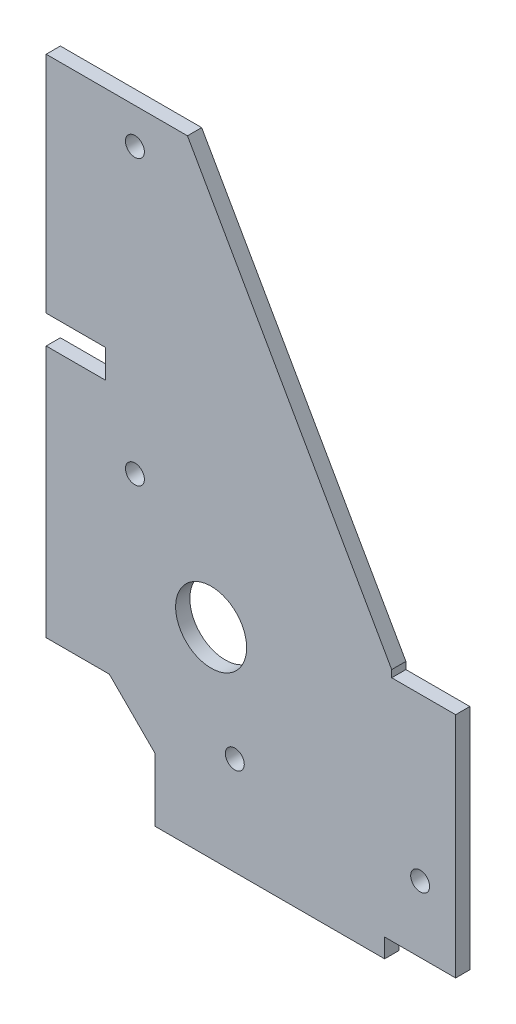
from build123d import *

# Parameters (mm, degrees)
BOSS_EXTRUDE1_DEPTH     = 6
SKETCH2_R               = 4
SKETCH2_R_2             = 15
CUT_EXTRUDE1_DEPTH      = 313.353853826
CROQUIS2_W              = 97
CROQUIS2_H              = 0.3
CORTAR_EXTRUIR1_DEPTH   = 10
CORTAR_EXTRUIR2_DEPTH   = 10
CROQUIS4_R              = 4
CORTAR_EXTRUIR3_DEPTH   = 6
SALIENTE_EXTRUIR2_DEPTH = 6
CROQUIS7_W              = 0.3
CROQUIS7_H              = 222.05
CORTAR_EXTRUIR4_DEPTH   = 6
CROQUIS8_W              = 25
CROQUIS8_H              = 12
CORTAR_EXTRUIR5_DEPTH   = 6
SALIENTE_EXTRUIR3_DEPTH = 10
CORTAR_EXTRUIR6_DEPTH   = 10
SALIENTE_EXTRUIR4_DEPTH = 16
CROQUIS12_W             = 25.313873874
CROQUIS12_H             = 10
CORTAR_EXTRUIR7_DEPTH   = 67
CROQUIS13_R             = 4
CORTAR_EXTRUIR8_DEPTH   = 10
SALIENTE_EXTRUIR5_DEPTH = 6
CROQUIS15_R             = 4
CORTAR_EXTRUIR9_DEPTH   = 10
SALIENTE_EXTRUIR7_DEPTH = 6
CROQUIS18_R             = 4
CORTAR_EXTRUIR10_DEPTH  = 6
SALIENTE_EXTRUIR8_DEPTH = 6


with BuildPart() as part:
    # Sketch1 → Boss-Extrude1 (new body)
    with BuildSketch(Plane.XY):
        Polygon((0, 0), (143.3, 0), (143.3, 8.3), (173.3, 8.3), (173.3, 60), (60, 259.8), (0, 259.8), align=None)
    extrude(amount=BOSS_EXTRUDE1_DEPTH)

    # Sketch2 → Cut-Extrude1 (cut, through all)
    with BuildSketch(Plane.XY.offset(6)):
        with Locations((158.3, 36.3)):
            Circle(SKETCH2_R)
        with Locations((37.8, 244.8)):
            Circle(SKETCH2_R)
        with Locations((37.8, 125)):
            Circle(SKETCH2_R)
        with Locations((80, 43.8)):
            Circle(SKETCH2_R)
        with Locations((70, 85)):
            Circle(SKETCH2_R_2)
        Polygon((46.3, 0), (46.3, 19), (19, 46.3), (0, 46.3), (0, 0), align=None)
    extrude(amount=-CUT_EXTRUDE1_DEPTH, mode=Mode.SUBTRACT)

    # Croquis2 → Cortar-Extruir1 (cut)
    with BuildSketch(Plane.XY.offset(6)):
        with Locations((94.8, 0.15)):
            Rectangle(CROQUIS2_W, CROQUIS2_H)
    extrude(amount=-CORTAR_EXTRUIR1_DEPTH, mode=Mode.SUBTRACT)

    # Croquis3 → Cortar-Extruir2 (cut)
    with BuildSketch(Plane.XY.offset(6)):
        Polygon((46.3, 19), (19, 46.3), (27, 46.3), (46.3, 27), align=None)
    extrude(amount=-CORTAR_EXTRUIR2_DEPTH, mode=Mode.SUBTRACT)

    # Croquis4 → Cortar-Extruir3 (cut)
    with BuildSketch(Plane.XY.offset(6)):
        with Locations((80, 36.3)):
            Circle(CROQUIS4_R)
        with Locations((80, 43.8)):
            Circle(CROQUIS4_R)
    extrude(amount=-CORTAR_EXTRUIR3_DEPTH, mode=Mode.SUBTRACT)

    # Croquis6 → Saliente-Extruir2 (add)
    with BuildSketch(Plane.XY.offset(6)):
        with BuildLine():
            ThreePointArc((81.391941091, 40.05), (83.283882181, 41.516117819), (84, 43.8))
            ThreePointArc((84, 43.8), (77.716117819, 47.083882181), (78.608058909, 40.05))
            ThreePointArc((78.608058909, 40.05), (80, 40.3), (81.391941091, 40.05))
        make_face()
    extrude(amount=-SALIENTE_EXTRUIR2_DEPTH)

    # Croquis7 → Cortar-Extruir4 (cut)
    with BuildSketch(Plane.XY.offset(6)):
        with Locations((0.15, 148.775)):
            Rectangle(CROQUIS7_W, CROQUIS7_H)
    extrude(amount=-CORTAR_EXTRUIR4_DEPTH, mode=Mode.SUBTRACT)

    # Croquis8 → Cortar-Extruir5 (cut)
    with BuildSketch(Plane.XY.offset(6)):
        with Locations((12.8, 159.05)):
            Rectangle(CROQUIS8_W, CROQUIS8_H)
    extrude(amount=-CORTAR_EXTRUIR5_DEPTH, mode=Mode.SUBTRACT)

    # Croquis10 → Cortar-Extruir6 (cut)
    with BuildSketch(Plane.XY.offset(6)):
        Polygon((147.986126126, 104.64), (146.286126126, 104.64), (146.286126126, 107.63788173), align=None)
    extrude(amount=-CORTAR_EXTRUIR6_DEPTH, mode=Mode.SUBTRACT)



with BuildPart() as body_2:
    # Croquis9 → Saliente-Extruir3 (new body)
    with BuildSketch(Plane.XY.offset(6)):
        Polygon((147.986126126, 104.64), (173.3, 60), (173.3, 104.64), align=None)
    extrude(amount=SALIENTE_EXTRUIR3_DEPTH)


with BuildPart() as part_1:
    add(part.part)

    add(body_2.part)  # Saliente-Extruir4 merges body 2
    # Croquis11 → Saliente-Extruir4 (add)
    with BuildSketch(Plane.XY.offset(16)):
        Polygon((173.3, 60), (173.3, 104.64), (147.986126126, 104.64), align=None)
    extrude(amount=-SALIENTE_EXTRUIR4_DEPTH)

    # Croquis12 → Cortar-Extruir7 (cut)
    with BuildSketch(Plane(origin=(0, 104.64, 0), x_dir=(1, 0, 0), z_dir=(0, 1, 0))):
        with Locations((160.643063063, -11)):
            Rectangle(CROQUIS12_W, CROQUIS12_H)
    extrude(amount=-CORTAR_EXTRUIR7_DEPTH, mode=Mode.SUBTRACT)

    # Croquis13 → Cortar-Extruir8 (cut)
    with BuildSketch(Plane.XY.offset(6)):
        with Locations((80, 41.8)):
            Circle(CROQUIS13_R)
    extrude(amount=-CORTAR_EXTRUIR8_DEPTH, mode=Mode.SUBTRACT)

    # Croquis14 → Saliente-Extruir5 (add)
    with BuildSketch(Plane.XY.offset(6)):
        with BuildLine():
            ThreePointArc((82.90473751, 39.05), (80, 37.8), (77.09526249, 39.05))
            ThreePointArc((77.09526249, 39.05), (78.519957777, 32.5838898), (84, 36.3))
            ThreePointArc((84, 36.3), (83.7161102, 37.780042223), (82.90473751, 39.05))
        make_face()
    extrude(amount=-SALIENTE_EXTRUIR5_DEPTH)

    # Croquis15 → Cortar-Extruir9 (cut)
    with BuildSketch(Plane.XY.offset(6)):
        with Locations((80, 47.3)):
            Circle(CROQUIS15_R)
    extrude(amount=-CORTAR_EXTRUIR9_DEPTH, mode=Mode.SUBTRACT)

    # Croquis16 → Saliente-Extruir7 (add)
    with BuildSketch(Plane.XY.offset(6)):
        with BuildLine():
            ThreePointArc((77.09526249, 44.55), (78.519957777, 38.0838898), (84, 41.8))
            ThreePointArc((84, 41.8), (83.7161102, 43.280042223), (82.90473751, 44.55))
            ThreePointArc((82.90473751, 44.55), (80, 43.3), (77.09526249, 44.55))
        make_face()
    extrude(amount=-SALIENTE_EXTRUIR7_DEPTH)

    # Croquis18 → Cortar-Extruir10 (cut)
    with BuildSketch(Plane.XY.offset(6)):
        with Locations((80, 41.8)):
            Circle(CROQUIS18_R)
    extrude(amount=-CORTAR_EXTRUIR10_DEPTH, mode=Mode.SUBTRACT)

    # Croquis19 → Saliente-Extruir8 (add)
    with BuildSketch(Plane.XY.offset(6)):
        with BuildLine():
            ThreePointArc((82.90473751, 44.55), (83.7161102, 45.819957777), (84, 47.3))
            ThreePointArc((84, 47.3), (78.519957777, 51.0161102), (77.09526249, 44.55))
            ThreePointArc((77.09526249, 44.55), (80, 45.8), (82.90473751, 44.55))
        make_face()
    extrude(amount=-SALIENTE_EXTRUIR8_DEPTH)


solid = part_1.part
